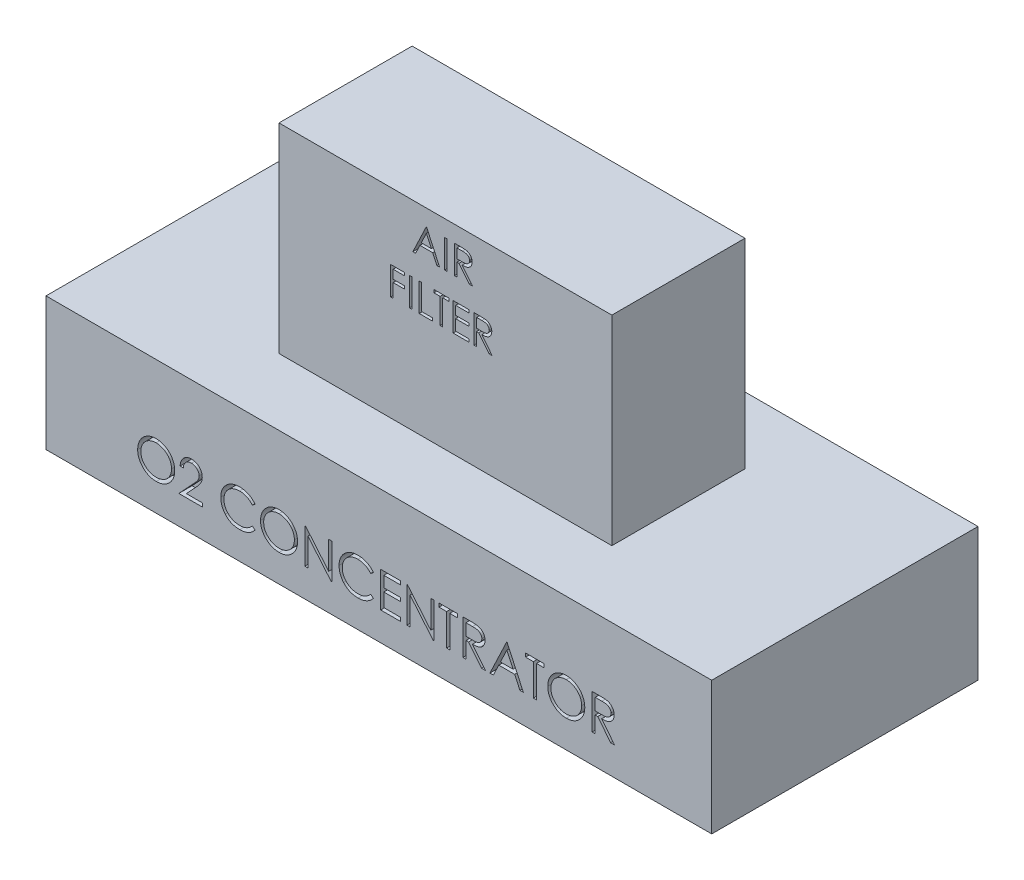
from build123d import *

# Parameters (mm, degrees)
SKETCH1_W           = 50
SKETCH1_H           = 10
BOSS_EXTRUDE1_DEPTH = 10
CUT_EXTRUDE1_DEPTH  = 1
SKETCH3_W           = 25
SKETCH3_H           = 10
BOSS_EXTRUDE2_DEPTH = 15
SKETCH4_W           = 0.189957264
SKETCH4_H           = 2.116666666
CUT_EXTRUDE2_DEPTH  = 1
SKETCH5_W           = 0.189957265
SKETCH5_H           = 2.116666667
CUT_EXTRUDE3_DEPTH  = 1


with BuildPart() as part:
    # Sketch1 → Boss-Extrude1 (new, symmetric)
    with BuildSketch(Plane.XY):
        Rectangle(SKETCH1_W, SKETCH1_H)
    extrude(amount=BOSS_EXTRUDE1_DEPTH, both=True)

    # Sketch2 → Cut-Extrude1 (cut)
    # profile 1 of 14: a face of its own
    with BuildSketch(Plane.XY.offset(10)):
        with BuildLine():
            add(Edge.make_bspline(
                [(-16.740999189, -0.149896772), (-16.692007347, -0.151137652), (-16.595783328, -0.153574843), (-16.454363613, -0.17223107), (-16.319354226, -0.204506752), (-16.189655371, -0.247492459), (-16.066818419, -0.304834762), (-15.94991878, -0.374144369), (-15.839234595, -0.456147406), (-15.736257717, -0.550209976), (-15.642022999, -0.65255342), (-15.558999859, -0.761771841), (-15.489420268, -0.877204864), (-15.432281012, -0.998505611), (-15.387454087, -1.125399753), (-15.356521238, -1.258563791), (-15.336762041, -1.39713492), (-15.334452019, -1.491649276), (-15.333280172, -1.53959529)],
                knots=[0, 0, 0, 0, 1.065120563, 2.091984664, 3.0946048, 4.079830382, 5.057816894, 6.036188127, 7.030412546, 8.04752943, 9.064399622, 10.05169764, 11.02544977, 11.989514704, 12.962713494, 13.945757189, 14.957906945, 16, 16, 16, 16], degree=3))
            add(Edge.make_bspline(
                [(-15.333280172, -1.53959529), (-15.334451848, -1.587188121), (-15.336761355, -1.680999106), (-15.356543705, -1.818690876), (-15.387568746, -1.951051105), (-15.431864733, -2.07785883), (-15.488731613, -2.199247822), (-15.55877451, -2.314898674), (-15.641280068, -2.424849301), (-15.735174533, -2.527895185), (-15.837531273, -2.62238732), (-15.947318439, -2.704724804), (-16.062066961, -2.775575779), (-16.183253466, -2.832108675), (-16.309270756, -2.877293401), (-16.441246679, -2.908100448), (-16.578562824, -2.927972201), (-16.672203404, -2.930254056), (-16.719798602, -2.931413866)],
                knots=[0, 0, 0, 0, 1.043624062, 2.057103931, 3.04512605, 4.022047818, 4.998200453, 5.980619268, 6.982898556, 8.009068085, 9.034988726, 10.034168286, 11.015286542, 11.987931943, 12.962482838, 13.94673481, 14.956375938, 16, 16, 16, 16], degree=3))
            add(Edge.make_bspline(
                [(-16.719798602, -2.931413866), (-16.767744367, -2.930242603), (-16.862258232, -2.927933733), (-17.001003491, -2.908141837), (-17.134261071, -2.877192161), (-17.261649896, -2.832961814), (-17.383241004, -2.775798788), (-17.499272197, -2.706096668), (-17.609277743, -2.623390079), (-17.712345611, -2.529526062), (-17.806650065, -2.427342805), (-17.888866974, -2.317855005), (-17.958584768, -2.203210702), (-18.015555858, -2.08309174), (-18.060659348, -1.958078804), (-18.091430252, -1.827337991), (-18.111338978, -1.691614674), (-18.113633178, -1.599204864), (-18.114797266, -1.552315642)],
                knots=[0, 0, 0, 0, 1.053102029, 2.075944431, 3.073151272, 4.055350789, 5.033113405, 6.020478099, 7.024410459, 8.052272461, 9.079885166, 10.07527673, 11.055994387, 12.023226415, 12.992069828, 13.970394897, 14.97016774, 16, 16, 16, 16], degree=3))
            add(Edge.make_bspline(
                [(-18.114797266, -1.552315642), (-18.114393107, -1.520843327), (-18.113589888, -1.458295733), (-18.103919978, -1.365414434), (-18.089888215, -1.274026854), (-18.069778436, -1.184392863), (-18.043477593, -1.096731881), (-18.012444215, -1.01043934), (-17.97454088, -0.926389739), (-17.931693009, -0.844184913), (-17.883870094, -0.765106318), (-17.831047355, -0.690358062), (-17.775080142, -0.619312903), (-17.713724481, -0.553811895), (-17.649002526, -0.491949547), (-17.579864347, -0.434676541), (-17.506731817, -0.381476429), (-17.429290256, -0.333533671), (-17.34944787, -0.290172897), (-17.26714221, -0.252963521), (-17.183491112, -0.221027511), (-17.098102777, -0.195143077), (-17.011203955, -0.174708145), (-16.922604987, -0.160793062), (-16.832376456, -0.151098489), (-16.771589328, -0.150299068), (-16.740999189, -0.149896772)],
                knots=[0, 0, 0, 0, 1.037015668, 2.060948919, 3.074880161, 4.083647147, 5.086022904, 6.090072063, 7.104153813, 8.122640571, 9.144368836, 10.147691507, 11.138137339, 12.123020368, 13.103399296, 14.087645067, 15.080126199, 16.082011238, 17.087798457, 18.072939717, 19.057185487, 20.037253025, 21.01195951, 21.997135196, 22.992090687, 24, 24, 24, 24], degree=3))
        make_face()
        with BuildLine():
            add(Edge.make_bspline(
                [(-16.729338866, -0.421264293), (-16.754447548, -0.421570371), (-16.804424869, -0.4221796), (-16.878723299, -0.430204576), (-16.952044582, -0.441642051), (-17.024403862, -0.457956653), (-17.095498378, -0.480184717), (-17.165990818, -0.505766832), (-17.235238364, -0.536928014), (-17.303012412, -0.572134761), (-17.36871607, -0.61110329), (-17.430713766, -0.654171233), (-17.489166003, -0.700328592), (-17.543929663, -0.749683089), (-17.594843942, -0.802486061), (-17.642910949, -0.85793701), (-17.686204025, -0.91762088), (-17.725880622, -0.979919223), (-17.761386073, -1.044750895), (-17.792958692, -1.11143335), (-17.818785056, -1.18051053), (-17.839847686, -1.251233018), (-17.857310043, -1.323488806), (-17.868372592, -1.397826025), (-17.876485745, -1.47387114), (-17.877060152, -1.525262184), (-17.877350685, -1.551255613)],
                knots=[0, 0, 0, 0, 1.008559885, 2.007477868, 2.99961109, 3.989939068, 4.984837346, 5.991145699, 7.001802488, 8.033829008, 9.059044045, 10.069351652, 11.065060232, 12.050310815, 13.029377138, 14.011219647, 14.996725999, 15.989392538, 16.977580475, 17.965360261, 18.951710183, 19.937753436, 20.929683414, 21.935841486, 22.955955122, 24, 24, 24, 24], degree=3))
            add(Edge.make_bspline(
                [(-17.877350685, -1.551255613), (-17.87638695, -1.589478244), (-17.874490985, -1.664673984), (-17.857892108, -1.77486776), (-17.832324306, -1.880767833), (-17.794634511, -1.981794753), (-17.747500415, -2.078816919), (-17.689271754, -2.170973641), (-17.620284231, -2.258289826), (-17.541919542, -2.340155892), (-17.456252972, -2.414878613), (-17.365287158, -2.480467618), (-17.269996633, -2.535962272), (-17.170132903, -2.581172058), (-17.066229108, -2.616996444), (-16.957615722, -2.641548742), (-16.845016267, -2.657707568), (-16.768263926, -2.659259354), (-16.729338866, -2.660046345)],
                knots=[0, 0, 0, 0, 1.032063989, 2.030389145, 3.003944642, 3.970395727, 4.937377036, 5.913328081, 6.909231446, 7.93887556, 8.970685674, 9.976071282, 10.964166581, 11.944589148, 12.933237628, 13.927779006, 14.949070134, 16, 16, 16, 16], degree=3))
            add(Edge.make_bspline(
                [(-16.729338866, -2.660046345), (-16.703175731, -2.659686886), (-16.651286376, -2.658973971), (-16.574107023, -2.651793424), (-16.498318101, -2.640278856), (-16.424025913, -2.623700325), (-16.351314776, -2.602951544), (-16.279881205, -2.578301654), (-16.210486069, -2.547548601), (-16.142253929, -2.51357009), (-16.076942485, -2.474834971), (-16.01459491, -2.433228751), (-15.956782711, -2.387139377), (-15.90206002, -2.338518173), (-15.850936707, -2.286384788), (-15.803758487, -2.230807002), (-15.76068422, -2.171434005), (-15.72102269, -2.109230157), (-15.685641652, -2.044221085), (-15.654814595, -1.977296864), (-15.628661579, -1.908622287), (-15.607548959, -1.838098301), (-15.591004592, -1.76585885), (-15.579604891, -1.691807208), (-15.571630774, -1.616091514), (-15.571029733, -1.564880385), (-15.570726754, -1.539065275)],
                knots=[0, 0, 0, 0, 1.047197238, 2.076906641, 3.100256066, 4.114471768, 5.12198147, 6.126382909, 7.136867548, 8.15857795, 9.17633901, 10.174870724, 11.156907918, 12.133735059, 13.104061851, 14.077631395, 15.04955518, 16.038496417, 17.029181396, 18.010275684, 18.986308667, 19.968651475, 20.955262928, 21.950658345, 22.966943676, 24, 24, 24, 24], degree=3))
            add(Edge.make_bspline(
                [(-15.570726754, -1.539065275), (-15.571029976, -1.513426769), (-15.571631473, -1.462568069), (-15.579601082, -1.387380426), (-15.591016636, -1.31386163), (-15.607468207, -1.242300302), (-15.628672787, -1.172678203), (-15.654819162, -1.105060721), (-15.685650906, -1.039195955), (-15.721035695, -0.975246694), (-15.760810752, -0.913882458), (-15.804273662, -0.855218729), (-15.852174848, -0.800357193), (-15.903145712, -0.747943466), (-15.958459417, -0.699095418), (-16.017865401, -0.653796846), (-16.080642467, -0.610954549), (-16.14711127, -0.572306059), (-16.215709378, -0.536614348), (-16.286099096, -0.506035316), (-16.357482999, -0.48005163), (-16.42967956, -0.457889401), (-16.503296454, -0.441705949), (-16.577836254, -0.430194269), (-16.65319583, -0.422182394), (-16.703877312, -0.421571298), (-16.729338866, -0.421264293)],
                knots=[0, 0, 0, 0, 1.02996197, 2.043119294, 3.035359645, 4.018872909, 4.991431989, 5.957985074, 6.929999688, 7.912076566, 8.892894881, 9.867085534, 10.843653904, 11.817741046, 12.803660682, 13.806313499, 14.818574707, 15.856120519, 16.894564902, 17.924820532, 18.937903209, 19.946497019, 20.957711757, 21.963978472, 22.977135795, 24, 24, 24, 24], degree=3))
        make_face(mode=Mode.SUBTRACT)
    # profile 2 of 14: a face of its own
    with BuildSketch(Plane.XY.offset(10)):
        with BuildLine():
            Line((-14.688782309, -1.031841216), (-14.92622889, -1.031841216))
            add(Edge.make_bspline(
                [(-14.92622889, -1.031841216), (-14.92468134, -1.00034001), (-14.921641993, -0.938472478), (-14.907408703, -0.848269287), (-14.887042682, -0.76204929), (-14.858247357, -0.680504772), (-14.822486064, -0.602914721), (-14.779600864, -0.529587328), (-14.728805513, -0.460802322), (-14.671196851, -0.397197363), (-14.608627701, -0.338847235), (-14.541116664, -0.288459046), (-14.470174292, -0.245885568), (-14.396015818, -0.210294391), (-14.317804558, -0.183579151), (-14.236250255, -0.16375684), (-14.150994598, -0.151830674), (-14.092907201, -0.150548741), (-14.063364975, -0.149896772)],
                knots=[0, 0, 0, 0, 1.10065271, 2.161652631, 3.183658789, 4.190468796, 5.17591951, 6.163126047, 7.15150782, 8.156236427, 9.156009102, 10.134482811, 11.092018607, 12.041330605, 13.001268258, 13.972401359, 14.968799086, 16, 16, 16, 16], degree=3))
            add(Edge.make_bspline(
                [(-14.063364975, -0.149896772), (-14.034352978, -0.150575962), (-13.977345441, -0.151910547), (-13.8941438, -0.163371563), (-13.814937154, -0.1813221), (-13.739880331, -0.206506968), (-13.669572175, -0.240361862), (-13.603484516, -0.28103024), (-13.54083057, -0.328065469), (-13.484431394, -0.383441864), (-13.432642549, -0.442559143), (-13.387964058, -0.505672022), (-13.349702917, -0.570857256), (-13.31781104, -0.638611909), (-13.294334078, -0.709573936), (-13.276510075, -0.782710214), (-13.266435185, -0.85877778), (-13.264888942, -0.910263093), (-13.264102822, -0.936438572)],
                knots=[0, 0, 0, 0, 1.111607364, 2.184268762, 3.212621178, 4.221274766, 5.211760367, 6.196651075, 7.1921475, 8.207485113, 9.220403448, 10.201281604, 11.166441695, 12.114753415, 13.065576456, 14.026450734, 14.996634279, 16, 16, 16, 16], degree=3))
            add(Edge.make_bspline(
                [(-13.264102822, -0.936438572), (-13.265382848, -0.973289614), (-13.267920438, -1.046345013), (-13.289627139, -1.153701487), (-13.323528966, -1.25771556), (-13.364348396, -1.341427687), (-13.40552697, -1.408883959), (-13.442634788, -1.464422801), (-13.486075449, -1.524222769), (-13.536481218, -1.588083613), (-13.592809401, -1.656505547), (-13.655570203, -1.729447238), (-13.725211169, -1.806155064), (-13.774089917, -1.858546798), (-13.799417659, -1.885694882)],
                knots=[0, 0, 0, 0, 1.184426356, 2.348067706, 3.509069118, 4.696110526, 5.333549288, 6.050745305, 6.844228056, 7.710549037, 8.667450064, 9.695053472, 10.805634456, 12, 12, 12, 12], degree=3))
            Line((-13.799417659, -1.885694882), (-14.461406007, -2.592204464))
            Line((-14.461406007, -2.592204464), (-13.230181882, -2.592204464))
            Line((-13.230181882, -2.592204464), (-13.230181882, -2.863571986))
            Line((-13.230181882, -2.863571986), (-15.027991711, -2.863571986))
            Line((-15.027991711, -2.863571986), (-14.001883271, -1.768561636))
            add(Edge.make_bspline(
                [(-14.001883271, -1.768561636), (-13.976900642, -1.742482559), (-13.928914125, -1.692389989), (-13.861042772, -1.619256918), (-13.800083537, -1.551410539), (-13.745641818, -1.488979041), (-13.698898632, -1.431049225), (-13.657417838, -1.379497276), (-13.624181944, -1.3320579), (-13.588111377, -1.27706946), (-13.553175808, -1.209931577), (-13.523155158, -1.127885277), (-13.504849886, -1.043424794), (-13.502653968, -0.986348849), (-13.501549403, -0.95763916)],
                knots=[0, 0, 0, 0, 1.329631726, 2.553950428, 3.673215718, 4.687767853, 5.603093632, 6.413772471, 7.123043292, 7.734684054, 8.834405432, 9.900288307, 10.943827018, 12, 12, 12, 12], degree=3))
            add(Edge.make_bspline(
                [(-13.501549403, -0.95763916), (-13.502029994, -0.93958596), (-13.502977146, -0.904006569), (-13.511336239, -0.851841501), (-13.523968586, -0.801521672), (-13.542070061, -0.752892299), (-13.565963251, -0.706442312), (-13.595047294, -0.662115169), (-13.628604069, -0.619261011), (-13.667423183, -0.579079649), (-13.710067606, -0.542278976), (-13.75511802, -0.509679221), (-13.802780897, -0.482435369), (-13.852855275, -0.460101892), (-13.905201552, -0.442582408), (-13.959920973, -0.430442886), (-14.016862342, -0.422821008), (-14.055743616, -0.421789759), (-14.075555313, -0.421264293)],
                knots=[0, 0, 0, 0, 0.991446411, 1.95395049, 2.89581595, 3.838931463, 4.798493298, 5.75982156, 6.748411868, 7.785213223, 8.824556874, 9.840280684, 10.836137867, 11.835679398, 12.848801643, 13.863922112, 14.911575587, 16, 16, 16, 16], degree=3))
            add(Edge.make_bspline(
                [(-14.075555313, -0.421264293), (-14.096246359, -0.421804824), (-14.136880157, -0.422866336), (-14.196539188, -0.430291802), (-14.253451651, -0.443102051), (-14.307760708, -0.460622513), (-14.359558252, -0.482891773), (-14.408592381, -0.510628985), (-14.454753017, -0.543727221), (-14.498126937, -0.581253117), (-14.538089588, -0.623032792), (-14.573201214, -0.66960699), (-14.603880796, -0.720125334), (-14.630648491, -0.774451512), (-14.652386423, -0.833078477), (-14.668997078, -0.895798111), (-14.682140706, -0.962338084), (-14.686531671, -1.008288713), (-14.688782309, -1.031841216)],
                knots=[0, 0, 0, 0, 1.031018746, 2.02475058, 2.990194455, 3.934040569, 4.864654155, 5.795059489, 6.735614925, 7.690564532, 8.649604399, 9.611025574, 10.590972636, 11.591080095, 12.624614302, 13.701020113, 14.821632451, 16, 16, 16, 16], degree=3))
        make_face()
    # profile 3 of 14: a face of its own
    with BuildSketch(Plane.XY.offset(10)):
        with BuildLine():
            Line((-9.295352822, -0.703232108), (-9.50311858, -0.862236516))
            add(Edge.make_bspline(
                [(-9.50311858, -0.862236516), (-9.517939698, -0.844572955), (-9.547382114, -0.809483977), (-9.594749487, -0.760211345), (-9.644114419, -0.714048915), (-9.695458041, -0.67077678), (-9.749704518, -0.631908154), (-9.805539765, -0.595417499), (-9.863897811, -0.562709149), (-9.944597039, -0.52304963), (-10.050164162, -0.481664144), (-10.183056689, -0.446963487), (-10.321782341, -0.424873669), (-10.416425765, -0.4224812), (-10.464565228, -0.421264293)],
                knots=[0, 0, 0, 0, 0.757959112, 1.505699292, 2.245454638, 2.979532153, 3.711538275, 4.438200793, 5.171680507, 5.909471876, 7.393775596, 8.890124382, 10.418191784, 12, 12, 12, 12], degree=3))
            add(Edge.make_bspline(
                [(-10.464565228, -0.421264293), (-10.491086532, -0.42156967), (-10.543882997, -0.422177588), (-10.622236307, -0.430197582), (-10.69912653, -0.441469747), (-10.774503651, -0.458195437), (-10.84827172, -0.479341405), (-10.920913001, -0.504609427), (-10.991375775, -0.535871716), (-11.060634801, -0.570424984), (-11.126991704, -0.609452874), (-11.189777365, -0.652023086), (-11.248762793, -0.697659249), (-11.303994649, -0.746532406), (-11.355529396, -0.79842246), (-11.402993613, -0.853882409), (-11.44622306, -0.912734944), (-11.48607462, -0.974204009), (-11.521765199, -1.038110553), (-11.551647905, -1.104691113), (-11.578110111, -1.172805524), (-11.599049419, -1.243223366), (-11.61562331, -1.315449147), (-11.627059103, -1.389676707), (-11.634987888, -1.465750977), (-11.635592783, -1.517313969), (-11.635897694, -1.543305392)],
                knots=[0, 0, 0, 0, 1.054917814, 2.100044995, 3.131103042, 4.146048494, 5.169673617, 6.183595914, 7.203665975, 8.234915748, 9.262203917, 10.264457458, 11.251630812, 12.227803204, 13.197192746, 14.159520551, 15.12972552, 16.100847026, 17.073214652, 18.039054194, 19.002613845, 19.979014051, 20.95965708, 21.949030935, 22.966165397, 24, 24, 24, 24], degree=3))
            add(Edge.make_bspline(
                [(-11.635897694, -1.543305392), (-11.634943819, -1.582411807), (-11.633071011, -1.659192064), (-11.616403521, -1.771655562), (-11.591075267, -1.879394404), (-11.553114682, -1.981735119), (-11.506306829, -2.079939651), (-11.447160652, -2.172346403), (-11.378658865, -2.260351783), (-11.299832369, -2.341875916), (-11.21334702, -2.416347601), (-11.120555444, -2.481926909), (-11.02168875, -2.536593517), (-10.91783856, -2.582083667), (-10.808205724, -2.61705155), (-10.692987391, -2.641668477), (-10.572434156, -2.657726554), (-10.490058479, -2.659263925), (-10.448134773, -2.660046345)],
                knots=[0, 0, 0, 0, 1.029171465, 2.020641659, 2.987623507, 3.938342917, 4.889210282, 5.84687017, 6.821220943, 7.821438502, 8.827599549, 9.822697543, 10.807740252, 11.797342354, 12.80366471, 13.83203677, 14.896651826, 16, 16, 16, 16], degree=3))
            add(Edge.make_bspline(
                [(-10.448134773, -2.660046345), (-10.40194405, -2.658769708), (-10.311029657, -2.65625698), (-10.177703827, -2.634969929), (-10.050072028, -2.600454717), (-9.928127394, -2.552150931), (-9.812213704, -2.489357529), (-9.702149562, -2.413234728), (-9.597842065, -2.323058429), (-9.535119726, -2.254203922), (-9.50311858, -2.219074122)],
                knots=[0, 0, 0, 0, 1.028121516, 2.023589091, 2.998037872, 3.967518031, 4.937445131, 5.927275754, 6.942489185, 8, 8, 8, 8], degree=3))
            Line((-9.50311858, -2.219074122), (-9.295352822, -2.376488485))
            add(Edge.make_bspline(
                [(-9.295352822, -2.376488485), (-9.31207306, -2.398062196), (-9.345433446, -2.441106281), (-9.399452304, -2.501787871), (-9.456358357, -2.558865326), (-9.51657428, -2.611878468), (-9.579407373, -2.661888094), (-9.645985847, -2.707473407), (-9.715434461, -2.749270683), (-9.787517906, -2.787542227), (-9.862159596, -2.821497527), (-9.939270091, -2.850566744), (-10.018517014, -2.875607583), (-10.099903988, -2.896208749), (-10.183599828, -2.912288676), (-10.269302508, -2.923038073), (-10.357196997, -2.930402496), (-10.416494976, -2.931073718), (-10.446544729, -2.931413866)],
                knots=[0, 0, 0, 0, 0.986787822, 1.968848986, 2.935600012, 3.899624008, 4.868462664, 5.837806735, 6.815139263, 7.798259679, 8.787526145, 9.778297419, 10.776456485, 11.791383307, 12.812564526, 13.85620153, 14.913611965, 16, 16, 16, 16], degree=3))
            add(Edge.make_bspline(
                [(-10.446544729, -2.931413866), (-10.475001549, -2.931215812), (-10.531271386, -2.930824185), (-10.614349609, -2.924480106), (-10.695228637, -2.91582465), (-10.773677313, -2.902791932), (-10.850123734, -2.88741258), (-10.92387489, -2.866796808), (-10.995656508, -2.843703093), (-11.065180194, -2.816560633), (-11.132505086, -2.785932328), (-11.197414039, -2.75131609), (-11.259877199, -2.713003014), (-11.320508678, -2.671837619), (-11.378412803, -2.626497635), (-11.434091361, -2.577612739), (-11.487856567, -2.525347695), (-11.521120501, -2.4876598), (-11.537844976, -2.468711041)],
                knots=[0, 0, 0, 0, 1.114604814, 2.203992996, 3.262667896, 4.300477797, 5.318619304, 6.316056647, 7.298880507, 8.271930387, 9.238335007, 10.195173496, 11.151986948, 12.108099108, 13.064862484, 14.031167946, 15.010108607, 16, 16, 16, 16], degree=3))
            add(Edge.make_bspline(
                [(-11.537844976, -2.468711041), (-11.564632635, -2.435795976), (-11.617884549, -2.370363225), (-11.686015274, -2.264313703), (-11.744335152, -2.153590712), (-11.791488378, -2.037612551), (-11.828350682, -1.916639467), (-11.853887657, -1.790610477), (-11.870482025, -1.659643283), (-11.872379684, -1.570564282), (-11.873344275, -1.525284893)],
                knots=[0, 0, 0, 0, 0.994628077, 1.977248131, 2.950237994, 3.925870899, 4.908910175, 5.911660606, 6.938484602, 8, 8, 8, 8], degree=3))
            add(Edge.make_bspline(
                [(-11.873344275, -1.525284893), (-11.872168623, -1.477693568), (-11.8698556, -1.384060607), (-11.850204017, -1.246648154), (-11.818590998, -1.11499799), (-11.773689779, -0.989355873), (-11.716762519, -0.869060959), (-11.646438829, -0.755032191), (-11.563535692, -0.646540325), (-11.468703304, -0.545231554), (-11.36470895, -0.452597639), (-11.253342941, -0.371101283), (-11.134823255, -0.303279113), (-11.010455594, -0.246585585), (-10.87930868, -0.203009116), (-10.741662323, -0.172504028), (-10.597775167, -0.153516685), (-10.499605358, -0.151116379), (-10.449724817, -0.149896772)],
                knots=[0, 0, 0, 0, 1.032925535, 2.032216505, 3.007276963, 3.968222605, 4.92396291, 5.891752235, 6.871517503, 7.883894988, 8.900124299, 9.891468569, 10.874487609, 11.85992873, 12.854644235, 13.869047385, 14.917252991, 16, 16, 16, 16], degree=3))
            add(Edge.make_bspline(
                [(-10.449724817, -0.149896772), (-10.419324591, -0.150261245), (-10.359150406, -0.150982684), (-10.270135008, -0.158017684), (-10.183470868, -0.169745232), (-10.09909828, -0.185707975), (-10.016606779, -0.205519462), (-9.936626835, -0.231327902), (-9.858689137, -0.260837661), (-9.783285224, -0.29482412), (-9.71077688, -0.332974574), (-9.641186687, -0.374866146), (-9.575067418, -0.420446904), (-9.511953825, -0.469329185), (-9.452901689, -0.522547144), (-9.396234381, -0.578636993), (-9.343876304, -0.639214348), (-9.311556924, -0.681853792), (-9.295352822, -0.703232108)],
                knots=[0, 0, 0, 0, 1.096760587, 2.17092713, 3.219439832, 4.250915756, 5.268269357, 6.278326846, 7.281116186, 8.274029601, 9.260640565, 10.235837813, 11.203064059, 12.156899882, 13.114053108, 14.069676657, 15.032185724, 16, 16, 16, 16], degree=3))
        make_face()
    # profile 4 of 14: a face of its own
    with BuildSketch(Plane.XY.offset(10)):
        with BuildLine():
            add(Edge.make_bspline(
                [(-7.514503463, -0.149896772), (-7.465511621, -0.151137652), (-7.369287601, -0.153574843), (-7.227867887, -0.17223107), (-7.092858499, -0.204506752), (-6.963159645, -0.247492459), (-6.840322692, -0.304834762), (-6.723423053, -0.374144369), (-6.612738869, -0.456147406), (-6.509761991, -0.550209976), (-6.415527273, -0.65255342), (-6.332504132, -0.761771841), (-6.262924541, -0.877204864), (-6.205785286, -0.998505611), (-6.16095836, -1.125399753), (-6.130025512, -1.258563791), (-6.110266315, -1.39713492), (-6.107956293, -1.491649276), (-6.106784446, -1.53959529)],
                knots=[0, 0, 0, 0, 1.065120563, 2.091984664, 3.0946048, 4.079830382, 5.057816894, 6.036188127, 7.030412546, 8.04752943, 9.064399622, 10.05169764, 11.02544977, 11.989514704, 12.962713494, 13.945757189, 14.957906945, 16, 16, 16, 16], degree=3))
            add(Edge.make_bspline(
                [(-6.106784446, -1.53959529), (-6.107956121, -1.587188121), (-6.110265629, -1.680999106), (-6.130047978, -1.818690876), (-6.16107302, -1.951051105), (-6.205369007, -2.07785883), (-6.262235886, -2.199247822), (-6.332278784, -2.314898674), (-6.414784342, -2.424849301), (-6.508678806, -2.527895185), (-6.611035547, -2.62238732), (-6.720822713, -2.704724804), (-6.835571234, -2.775575779), (-6.95675774, -2.832108675), (-7.082775029, -2.877293401), (-7.214750952, -2.908100448), (-7.352067097, -2.927972201), (-7.445707678, -2.930254056), (-7.493302875, -2.931413866)],
                knots=[0, 0, 0, 0, 1.043624062, 2.057103931, 3.04512605, 4.022047818, 4.998200453, 5.980619268, 6.982898556, 8.009068085, 9.034988726, 10.034168286, 11.015286542, 11.987931943, 12.962482838, 13.94673481, 14.956375938, 16, 16, 16, 16], degree=3))
            add(Edge.make_bspline(
                [(-7.493302875, -2.931413866), (-7.54124864, -2.930242603), (-7.635762506, -2.927933733), (-7.774507765, -2.908141837), (-7.907765345, -2.877192161), (-8.03515417, -2.832961814), (-8.156745277, -2.775798788), (-8.272776471, -2.706096668), (-8.382782017, -2.623390079), (-8.485849885, -2.529526062), (-8.580154338, -2.427342805), (-8.662371247, -2.317855005), (-8.732089041, -2.203210702), (-8.789060132, -2.08309174), (-8.834163622, -1.958078804), (-8.864934526, -1.827337991), (-8.884843252, -1.691614674), (-8.887137451, -1.599204864), (-8.88830154, -1.552315642)],
                knots=[0, 0, 0, 0, 1.053102029, 2.075944431, 3.073151272, 4.055350789, 5.033113405, 6.020478099, 7.024410459, 8.052272461, 9.079885166, 10.07527673, 11.055994387, 12.023226415, 12.992069828, 13.970394897, 14.97016774, 16, 16, 16, 16], degree=3))
            add(Edge.make_bspline(
                [(-8.88830154, -1.552315642), (-8.887897381, -1.520843327), (-8.887094162, -1.458295733), (-8.877424251, -1.365414434), (-8.863392489, -1.274026854), (-8.84328271, -1.184392863), (-8.816981866, -1.096731881), (-8.785948488, -1.01043934), (-8.748045153, -0.926389739), (-8.705197282, -0.844184913), (-8.657374368, -0.765106318), (-8.604551629, -0.690358062), (-8.548584416, -0.619312903), (-8.487228755, -0.553811895), (-8.422506799, -0.491949547), (-8.353368621, -0.434676541), (-8.280236091, -0.381476429), (-8.20279453, -0.333533671), (-8.122952143, -0.290172897), (-8.040646484, -0.252963521), (-7.956995385, -0.221027511), (-7.87160705, -0.195143077), (-7.784708228, -0.174708145), (-7.69610926, -0.160793062), (-7.60588073, -0.151098489), (-7.545093602, -0.150299068), (-7.514503463, -0.149896772)],
                knots=[0, 0, 0, 0, 1.037015668, 2.060948919, 3.074880161, 4.083647147, 5.086022904, 6.090072063, 7.104153813, 8.122640571, 9.144368836, 10.147691507, 11.138137339, 12.123020368, 13.103399296, 14.087645067, 15.080126199, 16.082011238, 17.087798457, 18.072939717, 19.057185487, 20.037253025, 21.01195951, 21.997135196, 22.992090687, 24, 24, 24, 24], degree=3))
        make_face()
        with BuildLine():
            add(Edge.make_bspline(
                [(-7.50284314, -0.421264293), (-7.527951821, -0.421570371), (-7.577929143, -0.4221796), (-7.652227572, -0.430204576), (-7.725548856, -0.441642051), (-7.797908135, -0.457956653), (-7.869002652, -0.480184717), (-7.939495091, -0.505766832), (-8.008742638, -0.536928014), (-8.076516685, -0.572134761), (-8.142220343, -0.61110329), (-8.20421804, -0.654171233), (-8.262670277, -0.700328592), (-8.317433937, -0.749683089), (-8.368348216, -0.802486061), (-8.416415222, -0.85793701), (-8.459708299, -0.91762088), (-8.499384895, -0.979919223), (-8.534890346, -1.044750895), (-8.566462966, -1.11143335), (-8.592289329, -1.18051053), (-8.613351959, -1.251233018), (-8.630814316, -1.323488806), (-8.641876866, -1.397826025), (-8.649990018, -1.47387114), (-8.650564425, -1.525262184), (-8.650854959, -1.551255613)],
                knots=[0, 0, 0, 0, 1.008559885, 2.007477868, 2.99961109, 3.989939068, 4.984837346, 5.991145699, 7.001802488, 8.033829008, 9.059044045, 10.069351652, 11.065060232, 12.050310815, 13.029377138, 14.011219647, 14.996725999, 15.989392538, 16.977580475, 17.965360261, 18.951710183, 19.937753436, 20.929683414, 21.935841486, 22.955955122, 24, 24, 24, 24], degree=3))
            add(Edge.make_bspline(
                [(-8.650854959, -1.551255613), (-8.649891224, -1.589478244), (-8.647995259, -1.664673984), (-8.631396382, -1.77486776), (-8.605828579, -1.880767833), (-8.568138785, -1.981794753), (-8.521004689, -2.078816919), (-8.462776028, -2.170973641), (-8.393788505, -2.258289826), (-8.315423815, -2.340155892), (-8.229757245, -2.414878613), (-8.138791432, -2.480467618), (-8.043500907, -2.535962272), (-7.943637176, -2.581172058), (-7.839733382, -2.616996444), (-7.731119995, -2.641548742), (-7.61852054, -2.657707568), (-7.5417682, -2.659259354), (-7.50284314, -2.660046345)],
                knots=[0, 0, 0, 0, 1.032063989, 2.030389145, 3.003944642, 3.970395727, 4.937377036, 5.913328081, 6.909231446, 7.93887556, 8.970685674, 9.976071282, 10.964166581, 11.944589148, 12.933237628, 13.927779006, 14.949070134, 16, 16, 16, 16], degree=3))
            add(Edge.make_bspline(
                [(-7.50284314, -2.660046345), (-7.476680005, -2.659686886), (-7.42479065, -2.658973971), (-7.347611297, -2.651793424), (-7.271822375, -2.640278856), (-7.197530187, -2.623700325), (-7.12481905, -2.602951544), (-7.053385478, -2.578301654), (-6.983990342, -2.547548601), (-6.915758203, -2.51357009), (-6.850446758, -2.474834971), (-6.788099183, -2.433228751), (-6.730286984, -2.387139377), (-6.675564293, -2.338518173), (-6.624440981, -2.286384788), (-6.577262761, -2.230807002), (-6.534188494, -2.171434005), (-6.494526963, -2.109230157), (-6.459145926, -2.044221085), (-6.428318869, -1.977296864), (-6.402165852, -1.908622287), (-6.381053233, -1.838098301), (-6.364508866, -1.76585885), (-6.353109164, -1.691807208), (-6.345135047, -1.616091514), (-6.344534007, -1.564880385), (-6.344231027, -1.539065275)],
                knots=[0, 0, 0, 0, 1.047197238, 2.076906641, 3.100256066, 4.114471768, 5.12198147, 6.126382909, 7.136867548, 8.15857795, 9.17633901, 10.174870724, 11.156907918, 12.133735059, 13.104061851, 14.077631395, 15.04955518, 16.038496417, 17.029181396, 18.010275684, 18.986308667, 19.968651475, 20.955262928, 21.950658345, 22.966943676, 24, 24, 24, 24], degree=3))
            add(Edge.make_bspline(
                [(-6.344231027, -1.539065275), (-6.344534249, -1.513426769), (-6.345135747, -1.462568069), (-6.353105355, -1.387380426), (-6.364520909, -1.31386163), (-6.38097248, -1.242300302), (-6.402177061, -1.172678203), (-6.428323436, -1.105060721), (-6.45915518, -1.039195955), (-6.494539969, -0.975246694), (-6.534315026, -0.913882458), (-6.577777936, -0.855218729), (-6.625679122, -0.800357193), (-6.676649986, -0.747943466), (-6.731963691, -0.699095418), (-6.791369675, -0.653796846), (-6.854146741, -0.610954549), (-6.920615544, -0.572306059), (-6.989213652, -0.536614348), (-7.05960337, -0.506035316), (-7.130987273, -0.48005163), (-7.203183834, -0.457889401), (-7.276800728, -0.441705949), (-7.351340527, -0.430194269), (-7.426700104, -0.422182394), (-7.477381585, -0.421571298), (-7.50284314, -0.421264293)],
                knots=[0, 0, 0, 0, 1.02996197, 2.043119294, 3.035359645, 4.018872909, 4.991431989, 5.957985074, 6.929999688, 7.912076566, 8.892894881, 9.867085534, 10.843653904, 11.817741046, 12.803660682, 13.806313499, 14.818574707, 15.856120519, 16.894564902, 17.924820532, 18.937903209, 19.946497019, 20.957711757, 21.963978472, 22.977135795, 24, 24, 24, 24], degree=3))
        make_face(mode=Mode.SUBTRACT)
    # profile 5 of 14: a face of its own
    with BuildSketch(Plane.XY.offset(10)):
        Polygon((-5.564049403, -2.863571986), (-5.564049403, -0.217738652), (-5.514228022, -0.217738652), (-3.766239574, -2.30016637), (-3.766239574, -0.217738652), (-3.528792993, -0.217738652), (-3.528792993, -2.863571986), (-3.582854491, -2.863571986), (-5.326602822, -0.7859144), (-5.326602822, -2.863571986), align=None)
    # profile 6 of 14: a face of its own
    with BuildSketch(Plane.XY.offset(10)):
        with BuildLine():
            Line((-0.408066497, -0.703232108), (-0.615832256, -0.862236516))
            add(Edge.make_bspline(
                [(-0.615832256, -0.862236516), (-0.630653374, -0.844572955), (-0.660095789, -0.809483977), (-0.707463162, -0.760211345), (-0.756828095, -0.714048915), (-0.808171716, -0.67077678), (-0.862418193, -0.631908154), (-0.91825344, -0.595417499), (-0.976611486, -0.562709149), (-1.057310714, -0.52304963), (-1.162877837, -0.481664144), (-1.295770364, -0.446963487), (-1.434496016, -0.424873669), (-1.52913944, -0.4224812), (-1.577278904, -0.421264293)],
                knots=[0, 0, 0, 0, 0.757959112, 1.505699292, 2.245454638, 2.979532153, 3.711538275, 4.438200793, 5.171680507, 5.909471876, 7.393775596, 8.890124382, 10.418191784, 12, 12, 12, 12], degree=3))
            add(Edge.make_bspline(
                [(-1.577278904, -0.421264293), (-1.603800207, -0.42156967), (-1.656596672, -0.422177588), (-1.734949982, -0.430197582), (-1.811840205, -0.441469747), (-1.887217326, -0.458195437), (-1.960985396, -0.479341405), (-2.033626676, -0.504609427), (-2.104089451, -0.535871716), (-2.173348476, -0.570424984), (-2.239705379, -0.609452874), (-2.302491041, -0.652023086), (-2.361476469, -0.697659249), (-2.416708324, -0.746532406), (-2.468243071, -0.79842246), (-2.515707288, -0.853882409), (-2.558936735, -0.912734944), (-2.598788296, -0.974204009), (-2.634478874, -1.038110553), (-2.66436158, -1.104691113), (-2.690823786, -1.172805524), (-2.711763094, -1.243223366), (-2.728336985, -1.315449147), (-2.739772778, -1.389676707), (-2.747701563, -1.465750977), (-2.748306458, -1.517313969), (-2.748611369, -1.543305392)],
                knots=[0, 0, 0, 0, 1.054917814, 2.100044995, 3.131103042, 4.146048494, 5.169673617, 6.183595914, 7.203665975, 8.234915748, 9.262203917, 10.264457458, 11.251630812, 12.227803204, 13.197192746, 14.159520551, 15.12972552, 16.100847026, 17.073214652, 18.039054194, 19.002613845, 19.979014051, 20.95965708, 21.949030935, 22.966165397, 24, 24, 24, 24], degree=3))
            add(Edge.make_bspline(
                [(-2.748611369, -1.543305392), (-2.747657494, -1.582411807), (-2.745784687, -1.659192064), (-2.729117196, -1.771655562), (-2.703788942, -1.879394404), (-2.665828357, -1.981735119), (-2.619020504, -2.079939651), (-2.559874327, -2.172346403), (-2.49137254, -2.260351783), (-2.412546044, -2.341875916), (-2.326060695, -2.416347601), (-2.233269119, -2.481926909), (-2.134402426, -2.536593517), (-2.030552235, -2.582083667), (-1.920919399, -2.61705155), (-1.805701066, -2.641668477), (-1.685147832, -2.657726554), (-1.602772154, -2.659263925), (-1.560848448, -2.660046345)],
                knots=[0, 0, 0, 0, 1.029171465, 2.020641659, 2.987623507, 3.938342917, 4.889210282, 5.84687017, 6.821220943, 7.821438502, 8.827599549, 9.822697543, 10.807740252, 11.797342354, 12.80366471, 13.83203677, 14.896651826, 16, 16, 16, 16], degree=3))
            add(Edge.make_bspline(
                [(-1.560848448, -2.660046345), (-1.514657725, -2.658769708), (-1.423743332, -2.65625698), (-1.290417503, -2.634969929), (-1.162785704, -2.600454717), (-1.04084107, -2.552150931), (-0.924927379, -2.489357529), (-0.814863237, -2.413234728), (-0.71055574, -2.323058429), (-0.647833402, -2.254203922), (-0.615832256, -2.219074122)],
                knots=[0, 0, 0, 0, 1.028121516, 2.023589091, 2.998037872, 3.967518031, 4.937445131, 5.927275754, 6.942489185, 8, 8, 8, 8], degree=3))
            Line((-0.615832256, -2.219074122), (-0.408066497, -2.376488485))
            add(Edge.make_bspline(
                [(-0.408066497, -2.376488485), (-0.424786735, -2.398062196), (-0.458147122, -2.441106281), (-0.51216598, -2.501787871), (-0.569072032, -2.558865326), (-0.629287956, -2.611878468), (-0.692121048, -2.661888094), (-0.758699522, -2.707473407), (-0.828148136, -2.749270683), (-0.900231581, -2.787542227), (-0.974873271, -2.821497527), (-1.051983766, -2.850566744), (-1.131230689, -2.875607583), (-1.212617663, -2.896208749), (-1.296313503, -2.912288676), (-1.382016183, -2.923038073), (-1.469910672, -2.930402496), (-1.529208651, -2.931073718), (-1.559258404, -2.931413866)],
                knots=[0, 0, 0, 0, 0.986787822, 1.968848986, 2.935600012, 3.899624008, 4.868462664, 5.837806735, 6.815139263, 7.798259679, 8.787526145, 9.778297419, 10.776456485, 11.791383307, 12.812564526, 13.85620153, 14.913611965, 16, 16, 16, 16], degree=3))
            add(Edge.make_bspline(
                [(-1.559258404, -2.931413866), (-1.587715224, -2.931215812), (-1.643985061, -2.930824185), (-1.727063284, -2.924480106), (-1.807942312, -2.91582465), (-1.886390988, -2.902791932), (-1.962837409, -2.88741258), (-2.036588566, -2.866796808), (-2.108370183, -2.843703093), (-2.177893869, -2.816560633), (-2.245218761, -2.785932328), (-2.310127714, -2.75131609), (-2.372590874, -2.713003014), (-2.433222353, -2.671837619), (-2.491126479, -2.626497635), (-2.546805037, -2.577612739), (-2.600570242, -2.525347695), (-2.633834176, -2.4876598), (-2.650558651, -2.468711041)],
                knots=[0, 0, 0, 0, 1.114604814, 2.203992996, 3.262667896, 4.300477797, 5.318619304, 6.316056647, 7.298880507, 8.271930387, 9.238335007, 10.195173496, 11.151986948, 12.108099108, 13.064862484, 14.031167946, 15.010108607, 16, 16, 16, 16], degree=3))
            add(Edge.make_bspline(
                [(-2.650558651, -2.468711041), (-2.67734631, -2.435795976), (-2.730598224, -2.370363225), (-2.798728949, -2.264313703), (-2.857048827, -2.153590712), (-2.904202053, -2.037612551), (-2.941064358, -1.916639467), (-2.966601332, -1.790610477), (-2.9831957, -1.659643283), (-2.985093359, -1.570564282), (-2.98605795, -1.525284893)],
                knots=[0, 0, 0, 0, 0.994628077, 1.977248131, 2.950237994, 3.925870899, 4.908910175, 5.911660606, 6.938484602, 8, 8, 8, 8], degree=3))
            add(Edge.make_bspline(
                [(-2.98605795, -1.525284893), (-2.984882298, -1.477693568), (-2.982569275, -1.384060607), (-2.962917692, -1.246648154), (-2.931304673, -1.11499799), (-2.886403454, -0.989355873), (-2.829476194, -0.869060959), (-2.759152504, -0.755032191), (-2.676249367, -0.646540325), (-2.581416979, -0.545231554), (-2.477422625, -0.452597639), (-2.366056617, -0.371101283), (-2.247536931, -0.303279113), (-2.123169269, -0.246585585), (-1.992022355, -0.203009116), (-1.854375998, -0.172504028), (-1.710488843, -0.153516685), (-1.612319033, -0.151116379), (-1.562438492, -0.149896772)],
                knots=[0, 0, 0, 0, 1.032925535, 2.032216505, 3.007276963, 3.968222605, 4.92396291, 5.891752235, 6.871517503, 7.883894988, 8.900124299, 9.891468569, 10.874487609, 11.85992873, 12.854644235, 13.869047385, 14.917252991, 16, 16, 16, 16], degree=3))
            add(Edge.make_bspline(
                [(-1.562438492, -0.149896772), (-1.532038267, -0.150261245), (-1.471864081, -0.150982684), (-1.382848683, -0.158017684), (-1.296184543, -0.169745232), (-1.211811955, -0.185707975), (-1.129320454, -0.205519462), (-1.04934051, -0.231327902), (-0.971402812, -0.260837661), (-0.895998899, -0.29482412), (-0.823490555, -0.332974574), (-0.753900362, -0.374866146), (-0.687781094, -0.420446904), (-0.6246675, -0.469329185), (-0.565615364, -0.522547144), (-0.508948056, -0.578636993), (-0.456589979, -0.639214348), (-0.424270599, -0.681853792), (-0.408066497, -0.703232108)],
                knots=[0, 0, 0, 0, 1.096760587, 2.17092713, 3.219439832, 4.250915756, 5.268269357, 6.278326846, 7.281116186, 8.274029601, 9.260640565, 10.235837813, 11.203064059, 12.156899882, 13.114053108, 14.069676657, 15.032185724, 16, 16, 16, 16], degree=3))
        make_face()
    # profile 7 of 14: a face of its own
    with BuildSketch(Plane.XY.offset(10)):
        Polygon((0.134668546, -0.217738652), (1.627189913, -0.217738652), (1.627189913, -0.489106174), (0.372115127, -0.489106174), (0.372115127, -1.303208738), (1.627189913, -1.303208738), (1.627189913, -1.574576259), (0.372115127, -1.574576259), (0.372115127, -2.592204464), (1.627189913, -2.592204464), (1.627189913, -2.863571986), (0.134668546, -2.863571986), align=None)
    # profile 8 of 14: a face of its own
    with BuildSketch(Plane.XY.offset(10)):
        Polygon((2.102083076, -2.863571986), (2.102083076, -0.217738652), (2.151904456, -0.217738652), (3.899892905, -2.30016637), (3.899892905, -0.217738652), (4.137339486, -0.217738652), (4.137339486, -2.863571986), (4.083277987, -2.863571986), (2.339529657, -0.7859144), (2.339529657, -2.863571986), align=None)
    # profile 9 of 14: a face of its own
    with BuildSketch(Plane.XY.offset(10)):
        Polygon((4.510469828, -0.489106174), (4.510469828, -0.217738652), (5.901228375, -0.217738652), (5.901228375, -0.489106174), (5.324572392, -0.489106174), (5.324572392, -2.863571986), (5.087125811, -2.863571986), (5.087125811, -0.489106174), align=None)
    # profile 10 of 14: a face of its own
    with BuildSketch(Plane.XY.offset(10)):
        with BuildLine():
            Line((6.308279657, -0.217738652), (6.837764332, -0.217738652))
            add(Edge.make_bspline(
                [(6.837764332, -0.217738652), (6.8730984, -0.217856268), (6.940943723, -0.218082103), (7.038138993, -0.21934134), (7.126454715, -0.222950526), (7.205844713, -0.226056419), (7.276307529, -0.23171997), (7.338059231, -0.237133078), (7.390815407, -0.24421912), (7.422751259, -0.250800005), (7.437210947, -0.253779651)],
                knots=[0, 0, 0, 0, 1.410062039, 2.707475311, 3.878576406, 4.937260626, 5.877586885, 6.699081471, 7.410979367, 8, 8, 8, 8], degree=3))
            add(Edge.make_bspline(
                [(7.437210947, -0.253779651), (7.456568335, -0.258562385), (7.494870167, -0.268025823), (7.550016943, -0.288028021), (7.602566461, -0.311174999), (7.652300436, -0.338361859), (7.698969754, -0.369790413), (7.74305562, -0.4049181), (7.784758083, -0.443552714), (7.822390625, -0.486668339), (7.857874313, -0.53190189), (7.88780143, -0.58081485), (7.913599423, -0.631963742), (7.93413904, -0.685868755), (7.950677746, -0.742007118), (7.962339249, -0.800887339), (7.969332706, -0.862241172), (7.970044704, -0.904089114), (7.970405725, -0.925308264)],
                knots=[0, 0, 0, 0, 1.027469482, 2.033020251, 3.019912614, 3.986113645, 4.951240523, 5.91722682, 6.890402269, 7.87763091, 8.8651537, 9.85103654, 10.82876324, 11.815024772, 12.821070561, 13.842952187, 14.906261191, 16, 16, 16, 16], degree=3))
            add(Edge.make_bspline(
                [(7.970405725, -0.925308264), (7.969295232, -0.960562182), (7.967128374, -1.029351708), (7.946925468, -1.129183445), (7.913832504, -1.222308701), (7.86823097, -1.308610219), (7.810159104, -1.386405767), (7.740365958, -1.454736646), (7.658812597, -1.511916818), (7.582892817, -1.551568641), (7.515829106, -1.57696328), (7.4606194, -1.594831242), (7.400394958, -1.608636418), (7.335732807, -1.621003899), (7.266363853, -1.630341192), (7.192454359, -1.637179986), (7.113951613, -1.641454178), (7.060022674, -1.642090693), (7.032279723, -1.642418139)],
                knots=[0, 0, 0, 0, 1.260483769, 2.459530307, 3.627416485, 4.787058657, 5.939039949, 7.08810263, 8.267026773, 9.491475466, 10.141966685, 10.831826277, 11.566392101, 12.351337768, 13.187381173, 14.07005841, 15.007169909, 16, 16, 16, 16], degree=3))
            Line((7.032279723, -1.642418139), (8.004326665, -2.863571986))
            Line((8.004326665, -2.863571986), (7.710698527, -2.863571986))
            Line((7.710698527, -2.863571986), (6.738651585, -1.642418139))
            Line((6.738651585, -1.642418139), (6.545726238, -1.642418139))
            Line((6.545726238, -1.642418139), (6.545726238, -2.863571986))
            Line((6.545726238, -2.863571986), (6.308279657, -2.863571986))
            Line((6.308279657, -2.863571986), (6.308279657, -0.217738652))
        make_face()
        with BuildLine():
            Line((6.545726238, -0.489106174), (6.545726238, -1.371050618))
            Line((6.545726238, -1.371050618), (7.030159665, -1.374760721))
            add(Edge.make_bspline(
                [(7.030159665, -1.374760721), (7.052777789, -1.374770727), (7.096618157, -1.374790122), (7.160043064, -1.371771018), (7.219098149, -1.368336485), (7.273557527, -1.363083111), (7.323445527, -1.356312747), (7.368737215, -1.347843825), (7.409506522, -1.337977087), (7.457054822, -1.32270562), (7.510150295, -1.298510594), (7.567853244, -1.263309294), (7.616991916, -1.219033829), (7.658507204, -1.168405086), (7.691866953, -1.112739588), (7.715386185, -1.052704595), (7.730310531, -0.989815708), (7.7320708, -0.946591781), (7.732959144, -0.924778249)],
                knots=[0, 0, 0, 0, 1.146690395, 2.22261258, 3.21895312, 4.145990853, 4.996080663, 5.770904154, 6.481378293, 7.121626537, 8.300444488, 9.431385265, 10.535395872, 11.636531494, 12.74115979, 13.810798291, 14.895190096, 16, 16, 16, 16], degree=3))
            add(Edge.make_bspline(
                [(7.732959144, -0.924778249), (7.732050398, -0.90350078), (7.730249594, -0.861336599), (7.715547251, -0.799608619), (7.690684445, -0.741349675), (7.657178944, -0.686796761), (7.616358154, -0.637277544), (7.568492903, -0.594908565), (7.514891952, -0.559946172), (7.464794081, -0.537604468), (7.420015837, -0.523906721), (7.381137463, -0.514267449), (7.337207954, -0.506523118), (7.288014006, -0.500318215), (7.23376563, -0.494985013), (7.174188531, -0.491392895), (7.109677988, -0.489265747), (7.064965725, -0.489160603), (7.041819988, -0.489106174)],
                knots=[0, 0, 0, 0, 1.101028733, 2.181837193, 3.264309656, 4.369019818, 5.486613113, 6.575447106, 7.666700264, 8.788928104, 9.402425223, 10.0903467, 10.862060571, 11.710948788, 12.657782767, 13.684531032, 14.801375019, 16, 16, 16, 16], degree=3))
            Line((7.041819988, -0.489106174), (6.545726238, -0.489106174))
        make_face(mode=Mode.SUBTRACT)
    # profile 11 of 14: a face of its own
    with BuildSketch(Plane.XY.offset(10)):
        Polygon((9.632531793, -0.217738652), (10.85368564, -2.863571986), (10.595568485, -2.863571986), (10.204417644, -2.015548481), (9.0049944, -2.015548481), (8.60271325, -2.863571986), (8.343536067, -2.863571986), (9.598610853, -0.217738652), align=None)
        Polygon((9.61292125, -0.733442946), (9.13378797, -1.74418096), (10.079334177, -1.74418096), align=None, mode=Mode.SUBTRACT)
    # profile 12 of 14: a face of its own
    with BuildSketch(Plane.XY.offset(10)):
        Polygon((11.02329034, -0.489106174), (11.02329034, -0.217738652), (12.414048887, -0.217738652), (12.414048887, -0.489106174), (11.837392905, -0.489106174), (11.837392905, -2.863571986), (11.599946323, -2.863571986), (11.599946323, -0.489106174), align=None)
    # profile 13 of 14: a face of its own
    with BuildSketch(Plane.XY.offset(10)):
        with BuildLine():
            add(Edge.make_bspline(
                [(14.059214486, -0.149896772), (14.108206328, -0.151137652), (14.204430347, -0.153574843), (14.345850062, -0.17223107), (14.480859449, -0.204506752), (14.610558304, -0.247492459), (14.733395257, -0.304834762), (14.850294896, -0.374144369), (14.96097908, -0.456147406), (15.063955958, -0.550209976), (15.158190676, -0.65255342), (15.241213816, -0.761771841), (15.310793407, -0.877204864), (15.367932663, -0.998505611), (15.412759588, -1.125399753), (15.443692437, -1.258563791), (15.463451634, -1.39713492), (15.465761656, -1.491649276), (15.466933503, -1.53959529)],
                knots=[0, 0, 0, 0, 1.065120563, 2.091984664, 3.0946048, 4.079830382, 5.057816894, 6.036188127, 7.030412546, 8.04752943, 9.064399622, 10.05169764, 11.02544977, 11.989514704, 12.962713494, 13.945757189, 14.957906945, 16, 16, 16, 16], degree=3))
            add(Edge.make_bspline(
                [(15.466933503, -1.53959529), (15.465761828, -1.587188121), (15.46345232, -1.680999106), (15.44366997, -1.818690876), (15.412644929, -1.951051105), (15.368348942, -2.07785883), (15.311482062, -2.199247822), (15.241439165, -2.314898674), (15.158933607, -2.424849301), (15.065039142, -2.527895185), (14.962682402, -2.62238732), (14.852895236, -2.704724804), (14.738146715, -2.775575779), (14.616960209, -2.832108675), (14.490942919, -2.877293401), (14.358966996, -2.908100448), (14.221650851, -2.927972201), (14.128010271, -2.930254056), (14.080415073, -2.931413866)],
                knots=[0, 0, 0, 0, 1.043624062, 2.057103931, 3.04512605, 4.022047818, 4.998200453, 5.980619268, 6.982898556, 8.009068085, 9.034988726, 10.034168286, 11.015286542, 11.987931943, 12.962482838, 13.94673481, 14.956375938, 16, 16, 16, 16], degree=3))
            add(Edge.make_bspline(
                [(14.080415073, -2.931413866), (14.032469308, -2.930242603), (13.937955443, -2.927933733), (13.799210184, -2.908141837), (13.665952604, -2.877192161), (13.538563779, -2.832961814), (13.416972671, -2.775798788), (13.300941478, -2.706096668), (13.190935932, -2.623390079), (13.087868064, -2.529526062), (12.993563611, -2.427342805), (12.911346702, -2.317855005), (12.841628908, -2.203210702), (12.784657817, -2.08309174), (12.739554327, -1.958078804), (12.708783423, -1.827337991), (12.688874697, -1.691614674), (12.686580498, -1.599204864), (12.685416409, -1.552315642)],
                knots=[0, 0, 0, 0, 1.053102029, 2.075944431, 3.073151272, 4.055350789, 5.033113405, 6.020478099, 7.024410459, 8.052272461, 9.079885166, 10.07527673, 11.055994387, 12.023226415, 12.992069828, 13.970394897, 14.97016774, 16, 16, 16, 16], degree=3))
            add(Edge.make_bspline(
                [(12.685416409, -1.552315642), (12.685820568, -1.520843327), (12.686623787, -1.458295733), (12.696293698, -1.365414434), (12.71032546, -1.274026854), (12.730435239, -1.184392863), (12.756736082, -1.096731881), (12.78776946, -1.01043934), (12.825672796, -0.926389739), (12.868520667, -0.844184913), (12.916343581, -0.765106318), (12.96916632, -0.690358062), (13.025133533, -0.619312903), (13.086489194, -0.553811895), (13.151211149, -0.491949547), (13.220349328, -0.434676541), (13.293481858, -0.381476429), (13.370923419, -0.333533671), (13.450765805, -0.290172897), (13.533071465, -0.252963521), (13.616722563, -0.221027511), (13.702110898, -0.195143077), (13.78900972, -0.174708145), (13.877608688, -0.160793062), (13.967837219, -0.151098489), (14.028624347, -0.150299068), (14.059214486, -0.149896772)],
                knots=[0, 0, 0, 0, 1.037015668, 2.060948919, 3.074880161, 4.083647147, 5.086022904, 6.090072063, 7.104153813, 8.122640571, 9.144368836, 10.147691507, 11.138137339, 12.123020368, 13.103399296, 14.087645067, 15.080126199, 16.082011238, 17.087798457, 18.072939717, 19.057185487, 20.037253025, 21.01195951, 21.997135196, 22.992090687, 24, 24, 24, 24], degree=3))
        make_face()
        with BuildLine():
            add(Edge.make_bspline(
                [(14.070874809, -0.421264293), (14.045766128, -0.421570371), (13.995788806, -0.4221796), (13.921490377, -0.430204576), (13.848169093, -0.441642051), (13.775809813, -0.457956653), (13.704715297, -0.480184717), (13.634222858, -0.505766832), (13.564975311, -0.536928014), (13.497201264, -0.572134761), (13.431497606, -0.61110329), (13.369499909, -0.654171233), (13.311047672, -0.700328592), (13.256284012, -0.749683089), (13.205369733, -0.802486061), (13.157302727, -0.85793701), (13.11400965, -0.91762088), (13.074333053, -0.979919223), (13.038827603, -1.044750895), (13.007254983, -1.11143335), (12.981428619, -1.18051053), (12.96036599, -1.251233018), (12.942903633, -1.323488806), (12.931841083, -1.397826025), (12.92372793, -1.47387114), (12.923153523, -1.525262184), (12.92286299, -1.551255613)],
                knots=[0, 0, 0, 0, 1.008559885, 2.007477868, 2.99961109, 3.989939068, 4.984837346, 5.991145699, 7.001802488, 8.033829008, 9.059044045, 10.069351652, 11.065060232, 12.050310815, 13.029377138, 14.011219647, 14.996725999, 15.989392538, 16.977580475, 17.965360261, 18.951710183, 19.937753436, 20.929683414, 21.935841486, 22.955955122, 24, 24, 24, 24], degree=3))
            add(Edge.make_bspline(
                [(12.92286299, -1.551255613), (12.923826725, -1.589478244), (12.92572269, -1.664673984), (12.942321567, -1.77486776), (12.967889369, -1.880767833), (13.005579164, -1.981794753), (13.05271326, -2.078816919), (13.110941921, -2.170973641), (13.179929444, -2.258289826), (13.258294134, -2.340155892), (13.343960703, -2.414878613), (13.434926517, -2.480467618), (13.530217042, -2.535962272), (13.630080772, -2.581172058), (13.733984567, -2.616996444), (13.842597954, -2.641548742), (13.955197408, -2.657707568), (14.031949749, -2.659259354), (14.070874809, -2.660046345)],
                knots=[0, 0, 0, 0, 1.032063989, 2.030389145, 3.003944642, 3.970395727, 4.937377036, 5.913328081, 6.909231446, 7.93887556, 8.970685674, 9.976071282, 10.964166581, 11.944589148, 12.933237628, 13.927779006, 14.949070134, 16, 16, 16, 16], degree=3))
            add(Edge.make_bspline(
                [(14.070874809, -2.660046345), (14.097037944, -2.659686886), (14.148927299, -2.658973971), (14.226106652, -2.651793424), (14.301895574, -2.640278856), (14.376187762, -2.623700325), (14.448898899, -2.602951544), (14.52033247, -2.578301654), (14.589727607, -2.547548601), (14.657959746, -2.51357009), (14.723271191, -2.474834971), (14.785618766, -2.433228751), (14.843430965, -2.387139377), (14.898153655, -2.338518173), (14.949276968, -2.286384788), (14.996455188, -2.230807002), (15.039529455, -2.171434005), (15.079190985, -2.109230157), (15.114572023, -2.044221085), (15.14539908, -1.977296864), (15.171552096, -1.908622287), (15.192664716, -1.838098301), (15.209209083, -1.76585885), (15.220608784, -1.691807208), (15.228582902, -1.616091514), (15.229183942, -1.564880385), (15.229486922, -1.539065275)],
                knots=[0, 0, 0, 0, 1.047197238, 2.076906641, 3.100256066, 4.114471768, 5.12198147, 6.126382909, 7.136867548, 8.15857795, 9.17633901, 10.174870724, 11.156907918, 12.133735059, 13.104061851, 14.077631395, 15.04955518, 16.038496417, 17.029181396, 18.010275684, 18.986308667, 19.968651475, 20.955262928, 21.950658345, 22.966943676, 24, 24, 24, 24], degree=3))
            add(Edge.make_bspline(
                [(15.229486922, -1.539065275), (15.229183699, -1.513426769), (15.228582202, -1.462568069), (15.220612593, -1.387380426), (15.209197039, -1.31386163), (15.192745468, -1.242300302), (15.171540888, -1.172678203), (15.145394513, -1.105060721), (15.114562769, -1.039195955), (15.07917798, -0.975246694), (15.039402923, -0.913882458), (14.995940013, -0.855218729), (14.948038827, -0.800357193), (14.897067963, -0.747943466), (14.841754258, -0.699095418), (14.782348274, -0.653796846), (14.719571208, -0.610954549), (14.653102405, -0.572306059), (14.584504297, -0.536614348), (14.514114579, -0.506035316), (14.442730676, -0.48005163), (14.370534115, -0.457889401), (14.296917221, -0.441705949), (14.222377422, -0.430194269), (14.147017845, -0.422182394), (14.096336364, -0.421571298), (14.070874809, -0.421264293)],
                knots=[0, 0, 0, 0, 1.02996197, 2.043119294, 3.035359645, 4.018872909, 4.991431989, 5.957985074, 6.929999688, 7.912076566, 8.892894881, 9.867085534, 10.843653904, 11.817741046, 12.803660682, 13.806313499, 14.818574707, 15.856120519, 16.894564902, 17.924820532, 18.937903209, 19.946497019, 20.957711757, 21.963978472, 22.977135795, 24, 24, 24, 24], degree=3))
        make_face(mode=Mode.SUBTRACT)
    # profile 14 of 14: a face of its own
    with BuildSketch(Plane.XY.offset(10)):
        with BuildLine():
            Line((16.009668546, -0.217738652), (16.539153221, -0.217738652))
            add(Edge.make_bspline(
                [(16.539153221, -0.217738652), (16.574487288, -0.217856268), (16.642332612, -0.218082103), (16.739527882, -0.21934134), (16.827843604, -0.222950526), (16.907233601, -0.226056419), (16.977696418, -0.23171997), (17.03944812, -0.237133078), (17.092204296, -0.24421912), (17.124140148, -0.250800005), (17.138599836, -0.253779651)],
                knots=[0, 0, 0, 0, 1.410062039, 2.707475311, 3.878576406, 4.937260626, 5.877586885, 6.699081471, 7.410979367, 8, 8, 8, 8], degree=3))
            add(Edge.make_bspline(
                [(17.138599836, -0.253779651), (17.157957224, -0.258562385), (17.196259055, -0.268025823), (17.251405832, -0.288028021), (17.30395535, -0.311174999), (17.353689325, -0.338361859), (17.400358643, -0.369790413), (17.444444509, -0.4049181), (17.486146972, -0.443552714), (17.523779514, -0.486668339), (17.559263202, -0.53190189), (17.589190318, -0.58081485), (17.614988312, -0.631963742), (17.635527929, -0.685868755), (17.652066635, -0.742007118), (17.663728138, -0.800887339), (17.670721595, -0.862241172), (17.671433593, -0.904089114), (17.671794614, -0.925308264)],
                knots=[0, 0, 0, 0, 1.027469482, 2.033020251, 3.019912614, 3.986113645, 4.951240523, 5.91722682, 6.890402269, 7.87763091, 8.8651537, 9.85103654, 10.82876324, 11.815024772, 12.821070561, 13.842952187, 14.906261191, 16, 16, 16, 16], degree=3))
            add(Edge.make_bspline(
                [(17.671794614, -0.925308264), (17.670684121, -0.960562182), (17.668517263, -1.029351708), (17.648314357, -1.129183445), (17.615221393, -1.222308701), (17.569619859, -1.308610219), (17.511547993, -1.386405767), (17.441754847, -1.454736646), (17.360201486, -1.511916818), (17.284281706, -1.551568641), (17.217217995, -1.57696328), (17.162008289, -1.594831242), (17.101783847, -1.608636418), (17.037121696, -1.621003899), (16.967752742, -1.630341192), (16.893843248, -1.637179986), (16.815340502, -1.641454178), (16.761411563, -1.642090693), (16.733668612, -1.642418139)],
                knots=[0, 0, 0, 0, 1.260483769, 2.459530307, 3.627416485, 4.787058657, 5.939039949, 7.08810263, 8.267026773, 9.491475466, 10.141966685, 10.831826277, 11.566392101, 12.351337768, 13.187381173, 14.07005841, 15.007169909, 16, 16, 16, 16], degree=3))
            Line((16.733668612, -1.642418139), (17.705715554, -2.863571986))
            Line((17.705715554, -2.863571986), (17.412087416, -2.863571986))
            Line((17.412087416, -2.863571986), (16.440040474, -1.642418139))
            Line((16.440040474, -1.642418139), (16.247115127, -1.642418139))
            Line((16.247115127, -1.642418139), (16.247115127, -2.863571986))
            Line((16.247115127, -2.863571986), (16.009668546, -2.863571986))
            Line((16.009668546, -2.863571986), (16.009668546, -0.217738652))
        make_face()
        with BuildLine():
            Line((16.247115127, -0.489106174), (16.247115127, -1.371050618))
            Line((16.247115127, -1.371050618), (16.731548554, -1.374760721))
            add(Edge.make_bspline(
                [(16.731548554, -1.374760721), (16.754166678, -1.374770727), (16.798007046, -1.374790122), (16.861431953, -1.371771018), (16.920487038, -1.368336485), (16.974946416, -1.363083111), (17.024834416, -1.356312747), (17.070126104, -1.347843825), (17.110895411, -1.337977087), (17.15844371, -1.32270562), (17.211539184, -1.298510594), (17.269242132, -1.263309294), (17.318380804, -1.219033829), (17.359896093, -1.168405086), (17.393255842, -1.112739588), (17.416775074, -1.052704595), (17.43169942, -0.989815708), (17.433459689, -0.946591781), (17.434348033, -0.924778249)],
                knots=[0, 0, 0, 0, 1.146690395, 2.22261258, 3.21895312, 4.145990853, 4.996080663, 5.770904154, 6.481378293, 7.121626537, 8.300444488, 9.431385265, 10.535395872, 11.636531494, 12.74115979, 13.810798291, 14.895190096, 16, 16, 16, 16], degree=3))
            add(Edge.make_bspline(
                [(17.434348033, -0.924778249), (17.433439286, -0.90350078), (17.431638483, -0.861336599), (17.41693614, -0.799608619), (17.392073334, -0.741349675), (17.358567833, -0.686796761), (17.317747043, -0.637277544), (17.269881792, -0.594908565), (17.21628084, -0.559946172), (17.16618297, -0.537604468), (17.121404726, -0.523906721), (17.082526352, -0.514267449), (17.038596842, -0.506523118), (16.989402895, -0.500318215), (16.935154519, -0.494985013), (16.87557742, -0.491392895), (16.811066877, -0.489265747), (16.766354614, -0.489160603), (16.743208877, -0.489106174)],
                knots=[0, 0, 0, 0, 1.101028733, 2.181837193, 3.264309656, 4.369019818, 5.486613113, 6.575447106, 7.666700264, 8.788928104, 9.402425223, 10.0903467, 10.862060571, 11.710948788, 12.657782767, 13.684531032, 14.801375019, 16, 16, 16, 16], degree=3))
            Line((16.743208877, -0.489106174), (16.247115127, -0.489106174))
        make_face(mode=Mode.SUBTRACT)
    extrude(amount=-CUT_EXTRUDE1_DEPTH, mode=Mode.SUBTRACT)

    # Sketch3 → Boss-Extrude2 (add)
    with BuildSketch(Plane(origin=(0, 5, 0), x_dir=(1, 0, 0), z_dir=(0, 1, 0))):
        Rectangle(SKETCH3_W, SKETCH3_H)
    extrude(amount=BOSS_EXTRUDE2_DEPTH)

    # Sketch4 → Cut-Extrude2 (cut)
    # profile 1 of 3: a face of its own
    with BuildSketch(Plane.XY.offset(5)):
        Polygon((-1.413695471, 18.767259055), (-0.436772394, 16.650592389), (-0.643266118, 16.650592389), (-0.956186791, 17.329011192), (-1.915725386, 17.329011192), (-2.237550306, 16.650592389), (-2.444892053, 16.650592389), (-1.440832223, 18.767259055), align=None)
        Polygon((-1.429383906, 18.35469562), (-1.81269053, 17.546105209), (-1.056253564, 17.546105209), align=None, mode=Mode.SUBTRACT)
    # profile 2 of 3: a face of its own
    with BuildSketch(Plane.XY.offset(5)):
        with Locations((0.038120768, 17.708925722)):
            Rectangle(SKETCH4_W, SKETCH4_H)
    # profile 3 of 3: a face of its own
    with BuildSketch(Plane.XY.offset(5)):
        with BuildLine():
            Line((0.675834443, 18.767259055), (1.099422184, 18.767259055))
            add(Edge.make_bspline(
                [(1.099422184, 18.767259055), (1.127689438, 18.767164963), (1.181965696, 18.766984295), (1.259721912, 18.765976905), (1.33037449, 18.763089556), (1.393886488, 18.760604842), (1.450256741, 18.756074001), (1.499658103, 18.751743514), (1.541863044, 18.746074681), (1.567411725, 18.740809973), (1.578979475, 18.738426256)],
                knots=[0, 0, 0, 0, 1.410062039, 2.707475311, 3.878576406, 4.937260626, 5.877586885, 6.699081471, 7.410979367, 8, 8, 8, 8], degree=3))
            add(Edge.make_bspline(
                [(1.578979475, 18.738426256), (1.594465386, 18.734600069), (1.625106851, 18.727029319), (1.669224272, 18.71102756), (1.711263887, 18.692509978), (1.751051066, 18.67076049), (1.788386521, 18.645617647), (1.823655214, 18.617515497), (1.857017185, 18.586607806), (1.887123218, 18.552115306), (1.915510168, 18.515928465), (1.939451862, 18.476798097), (1.960090256, 18.435878983), (1.97652195, 18.392754973), (1.989752915, 18.347844283), (1.999082117, 18.300740106), (2.004676883, 18.25165704), (2.005246481, 18.218178686), (2.005535298, 18.201203366)],
                knots=[0, 0, 0, 0, 1.027469482, 2.033020251, 3.019912614, 3.986113645, 4.951240523, 5.91722682, 6.890402269, 7.87763091, 8.8651537, 9.85103654, 10.82876324, 11.815024772, 12.821070561, 13.842952187, 14.906261191, 16, 16, 16, 16], degree=3))
            add(Edge.make_bspline(
                [(2.005535298, 18.201203366), (2.004646904, 18.173000231), (2.002913417, 18.117968611), (1.986751092, 18.038103221), (1.960276721, 17.963603016), (1.923795494, 17.894561802), (1.877338001, 17.832325364), (1.821503485, 17.77766066), (1.756260796, 17.731916522), (1.695524971, 17.700195064), (1.641874003, 17.679879353), (1.597706238, 17.665584983), (1.549526685, 17.654540843), (1.497796963, 17.644646858), (1.4423018, 17.637177024), (1.383174205, 17.631705988), (1.320372008, 17.628286635), (1.277228857, 17.627777422), (1.255034497, 17.627515466)],
                knots=[0, 0, 0, 0, 1.260483769, 2.459530307, 3.627416485, 4.787058657, 5.939039949, 7.08810263, 8.267026773, 9.491475466, 10.141966685, 10.831826277, 11.566392101, 12.351337768, 13.187381173, 14.07005841, 15.007169909, 16, 16, 16, 16], degree=3))
            Line((1.255034497, 17.627515466), (2.03267205, 16.650592389))
            Line((2.03267205, 16.650592389), (1.797769539, 16.650592389))
            Line((1.797769539, 16.650592389), (1.020131986, 17.627515466))
            Line((1.020131986, 17.627515466), (0.865791708, 17.627515466))
            Line((0.865791708, 17.627515466), (0.865791708, 16.650592389))
            Line((0.865791708, 16.650592389), (0.675834443, 16.650592389))
            Line((0.675834443, 16.650592389), (0.675834443, 18.767259055))
        make_face()
        with BuildLine():
            Line((0.865791708, 18.550165038), (0.865791708, 17.844609483))
            Line((0.865791708, 17.844609483), (1.25333845, 17.8416414))
            add(Edge.make_bspline(
                [(1.25333845, 17.8416414), (1.271432949, 17.841633395), (1.306505243, 17.841617879), (1.357245169, 17.844033163), (1.404489237, 17.846780789), (1.448056739, 17.850983488), (1.48796714, 17.856399779), (1.52420049, 17.863174917), (1.556815935, 17.871068308), (1.594854575, 17.883285481), (1.637330954, 17.902641502), (1.683493313, 17.930802542), (1.72280425, 17.966222914), (1.756016481, 18.006725908), (1.78270428, 18.051258307), (1.801519666, 18.099286301), (1.813459143, 18.149597411), (1.814867358, 18.184176552), (1.815578033, 18.201627378)],
                knots=[0, 0, 0, 0, 1.146690395, 2.22261258, 3.21895312, 4.145990853, 4.996080663, 5.770904154, 6.481378293, 7.121626537, 8.300444488, 9.431385265, 10.535395872, 11.636531494, 12.74115979, 13.810798291, 14.895190096, 16, 16, 16, 16], degree=3))
            add(Edge.make_bspline(
                [(1.815578033, 18.201627378), (1.814851036, 18.218649353), (1.813410393, 18.252380698), (1.801648519, 18.301763082), (1.781758274, 18.348370237), (1.754953873, 18.392012569), (1.722297241, 18.431627942), (1.68400504, 18.465523125), (1.641124279, 18.49349304), (1.601045983, 18.511366403), (1.565223388, 18.5223246), (1.534120689, 18.530036018), (1.498977081, 18.536231483), (1.459621922, 18.541195405), (1.416223222, 18.545461967), (1.368561542, 18.548335661), (1.316953109, 18.550037379), (1.281183298, 18.550121495), (1.262666708, 18.550165038)],
                knots=[0, 0, 0, 0, 1.101028733, 2.181837193, 3.264309656, 4.369019818, 5.486613113, 6.575447106, 7.666700264, 8.788928104, 9.402425223, 10.0903467, 10.862060571, 11.710948788, 12.657782767, 13.684531032, 14.801375019, 16, 16, 16, 16], degree=3))
            Line((1.262666708, 18.550165038), (0.865791708, 18.550165038))
        make_face(mode=Mode.SUBTRACT)
    extrude(amount=-CUT_EXTRUDE2_DEPTH, mode=Mode.SUBTRACT)

    # Sketch5 → Cut-Extrude3 (cut)
    # profile 1 of 6: a face of its own
    with BuildSketch(Plane.XY.offset(5)):
        Polygon((-4.116386669, 14.98586414), (-3.085190088, 14.98586414), (-3.085190088, 14.768770123), (-3.926429404, 14.768770123), (-3.926429404, 14.117488071), (-3.085190088, 14.117488071), (-3.085190088, 13.900394054), (-3.926429404, 13.900394054), (-3.926429404, 12.869197473), (-4.116386669, 12.869197473), align=None)
    # profile 2 of 6: a face of its own
    with BuildSketch(Plane.XY.offset(5)):
        with Locations((-2.610296926, 13.927530807)):
            Rectangle(SKETCH5_W, SKETCH5_H)
    # profile 3 of 6: a face of its own
    with BuildSketch(Plane.XY.offset(5)):
        Polygon((-1.97258325, 14.98586414), (-1.782625985, 14.98586414), (-1.782625985, 13.08629149), (-0.968523421, 13.08629149), (-0.968523421, 12.869197473), (-1.97258325, 12.869197473), align=None)
    # profile 4 of 6: a face of its own
    with BuildSketch(Plane.XY.offset(5)):
        Polygon((-0.859976413, 14.768770123), (-0.859976413, 14.98586414), (0.252630425, 14.98586414), (0.252630425, 14.768770123), (-0.208694361, 14.768770123), (-0.208694361, 12.869197473), (-0.398651626, 12.869197473), (-0.398651626, 14.768770123), align=None)
    # profile 5 of 6: a face of its own
    with BuildSketch(Plane.XY.offset(5)):
        Polygon((0.578271451, 14.98586414), (1.772288545, 14.98586414), (1.772288545, 14.768770123), (0.768228715, 14.768770123), (0.768228715, 14.117488071), (1.772288545, 14.117488071), (1.772288545, 13.900394054), (0.768228715, 13.900394054), (0.768228715, 13.08629149), (1.772288545, 13.08629149), (1.772288545, 12.869197473), (0.578271451, 12.869197473), align=None)
    # profile 6 of 6: a face of its own
    with BuildSketch(Plane.XY.offset(5)):
        with BuildLine():
            Line((2.152203074, 14.98586414), (2.575790815, 14.98586414))
            add(Edge.make_bspline(
                [(2.575790815, 14.98586414), (2.604058069, 14.985770047), (2.658334328, 14.985589379), (2.736090543, 14.984581989), (2.806743121, 14.981694641), (2.870255119, 14.979209926), (2.926625372, 14.974679085), (2.976026734, 14.970348599), (3.018231675, 14.964679766), (3.043780356, 14.959415058), (3.055348106, 14.957031341)],
                knots=[0, 0, 0, 0, 1.410062039, 2.707475311, 3.878576406, 4.937260626, 5.877586885, 6.699081471, 7.410979367, 8, 8, 8, 8], degree=3))
            add(Edge.make_bspline(
                [(3.055348106, 14.957031341), (3.070834017, 14.953205154), (3.101475482, 14.945634403), (3.145592903, 14.929632645), (3.187632518, 14.911115062), (3.227419698, 14.889365574), (3.264755152, 14.864222731), (3.300023845, 14.836120581), (3.333385816, 14.80521289), (3.363491849, 14.770720391), (3.3918788, 14.734533549), (3.415820493, 14.695403182), (3.436458888, 14.654484068), (3.452890581, 14.611360058), (3.466121546, 14.566449367), (3.475450748, 14.51934519), (3.481045514, 14.470262124), (3.481615112, 14.43678377), (3.481903929, 14.419808451)],
                knots=[0, 0, 0, 0, 1.027469482, 2.033020251, 3.019912614, 3.986113645, 4.951240523, 5.91722682, 6.890402269, 7.87763091, 8.8651537, 9.85103654, 10.82876324, 11.815024772, 12.821070561, 13.842952187, 14.906261191, 16, 16, 16, 16], degree=3))
            add(Edge.make_bspline(
                [(3.481903929, 14.419808451), (3.481015535, 14.391605316), (3.479282048, 14.336573695), (3.463119723, 14.256708305), (3.436645352, 14.182208101), (3.400164125, 14.113166886), (3.353706632, 14.050930448), (3.297872116, 13.996265744), (3.232629427, 13.950521607), (3.171893603, 13.918800149), (3.118242634, 13.898484437), (3.074074869, 13.884190068), (3.025895316, 13.873145927), (2.974165594, 13.863251943), (2.918670431, 13.855782108), (2.859542836, 13.850311073), (2.79674064, 13.846891719), (2.753597488, 13.846382507), (2.731403128, 13.84612055)],
                knots=[0, 0, 0, 0, 1.260483769, 2.459530307, 3.627416485, 4.787058657, 5.939039949, 7.08810263, 8.267026773, 9.491475466, 10.141966685, 10.831826277, 11.566392101, 12.351337768, 13.187381173, 14.07005841, 15.007169909, 16, 16, 16, 16], degree=3))
            Line((2.731403128, 13.84612055), (3.509040681, 12.869197473))
            Line((3.509040681, 12.869197473), (3.274138171, 12.869197473))
            Line((3.274138171, 12.869197473), (2.496500617, 13.84612055))
            Line((2.496500617, 13.84612055), (2.342160339, 13.84612055))
            Line((2.342160339, 13.84612055), (2.342160339, 12.869197473))
            Line((2.342160339, 12.869197473), (2.152203074, 12.869197473))
            Line((2.152203074, 12.869197473), (2.152203074, 14.98586414))
        make_face()
        with BuildLine():
            Line((2.342160339, 14.768770123), (2.342160339, 14.063214567))
            Line((2.342160339, 14.063214567), (2.729707081, 14.060246485))
            add(Edge.make_bspline(
                [(2.729707081, 14.060246485), (2.747801581, 14.06023848), (2.782873875, 14.060222964), (2.833613801, 14.062638247), (2.880857868, 14.065385873), (2.924425371, 14.069588573), (2.964335771, 14.075004864), (3.000569121, 14.081780002), (3.033184566, 14.089673392), (3.071223206, 14.101890566), (3.113699585, 14.121246586), (3.159861944, 14.149407626), (3.199172882, 14.184827998), (3.232385113, 14.225330993), (3.259072912, 14.269863391), (3.277888297, 14.317891386), (3.289827774, 14.368202495), (3.291235989, 14.402781636), (3.291946664, 14.420232462)],
                knots=[0, 0, 0, 0, 1.146690395, 2.22261258, 3.21895312, 4.145990853, 4.996080663, 5.770904154, 6.481378293, 7.121626537, 8.300444488, 9.431385265, 10.535395872, 11.636531494, 12.74115979, 13.810798291, 14.895190096, 16, 16, 16, 16], degree=3))
            add(Edge.make_bspline(
                [(3.291946664, 14.420232462), (3.291219667, 14.437254438), (3.289779024, 14.470985782), (3.27801715, 14.520368166), (3.258126905, 14.566975322), (3.231322504, 14.610617653), (3.198665872, 14.650233027), (3.160373671, 14.68412821), (3.11749291, 14.712098124), (3.077414614, 14.729971487), (3.041592019, 14.740929684), (3.01048932, 14.748641103), (2.975345712, 14.754836567), (2.935990554, 14.75980049), (2.892591853, 14.764067051), (2.844930174, 14.766940746), (2.79332174, 14.768642464), (2.757551929, 14.768726579), (2.739035339, 14.768770123)],
                knots=[0, 0, 0, 0, 1.101028733, 2.181837193, 3.264309656, 4.369019818, 5.486613113, 6.575447106, 7.666700264, 8.788928104, 9.402425223, 10.0903467, 10.862060571, 11.710948788, 12.657782767, 13.684531032, 14.801375019, 16, 16, 16, 16], degree=3))
            Line((2.739035339, 14.768770123), (2.342160339, 14.768770123))
        make_face(mode=Mode.SUBTRACT)
    extrude(amount=-CUT_EXTRUDE3_DEPTH, mode=Mode.SUBTRACT)


solid = part.part
